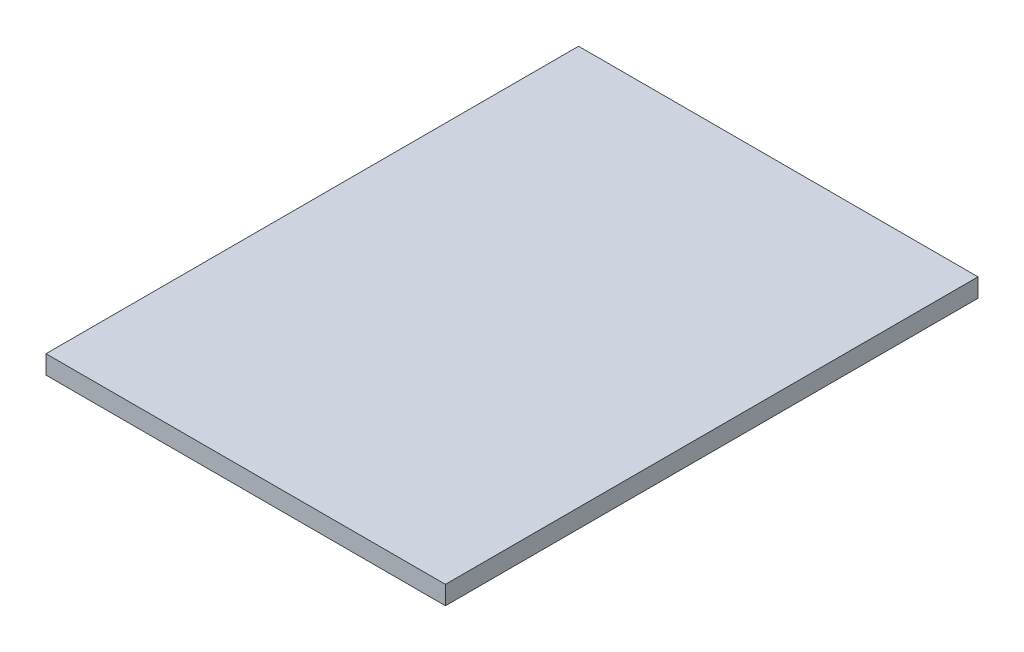
from build123d import *

# Parameters (mm, degrees)
SKETCH2_W           = 64.5
SKETCH2_H           = 86
BOSS_EXTRUDE3_DEPTH = 3


with BuildPart() as part:
    # Sketch2 → Boss-Extrude3 (new body)
    with BuildSketch(Plane(origin=(0, 0, 0), x_dir=(1, 0, 0), z_dir=(0, 1, 0))):
        Rectangle(SKETCH2_W, SKETCH2_H)
    extrude(amount=BOSS_EXTRUDE3_DEPTH)


solid = part.part
